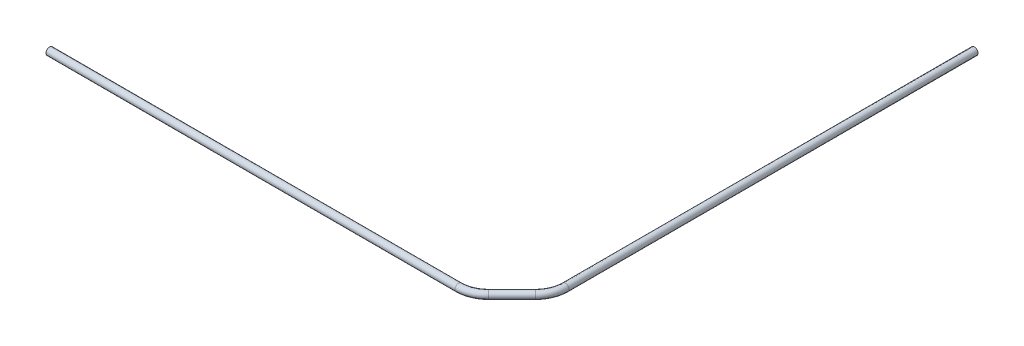
from build123d import *

# Parameters (mm, degrees)
SKETCH_2_R = 6


with BuildPart() as part:
    # По траектории1: sweep along a path in Эскиз1
    with BuildLine(Plane(origin=(0, 0, 0), x_dir=(1, 0, 0), z_dir=(0, 1, 0))) as sweep_1_path:
        Line((18, 750), (18, 70.710678119))
        ThreePointArc((18, 70.710678119), (14.193976626, 51.5765065), (3.355339059, 35.355339059))
        Line((3.355339059, 35.355339059), (-35.355339059, -3.355339059))
        ThreePointArc((-35.355339059, -3.355339059), (-51.5765065, -14.193976626), (-70.710678119, -18))
        Line((-70.710678119, -18), (-750, -18))
    # Эскиз2 → По траектории1 (sweep)
    with BuildSketch(Plane(origin=(-750, -400, -12), x_dir=(0, 0, 1), z_dir=(-1, 0, 0))):
        with Locations((30, 400)):
            Circle(SKETCH_2_R)
    sweep(path=sweep_1_path.line)


solid = part.part
